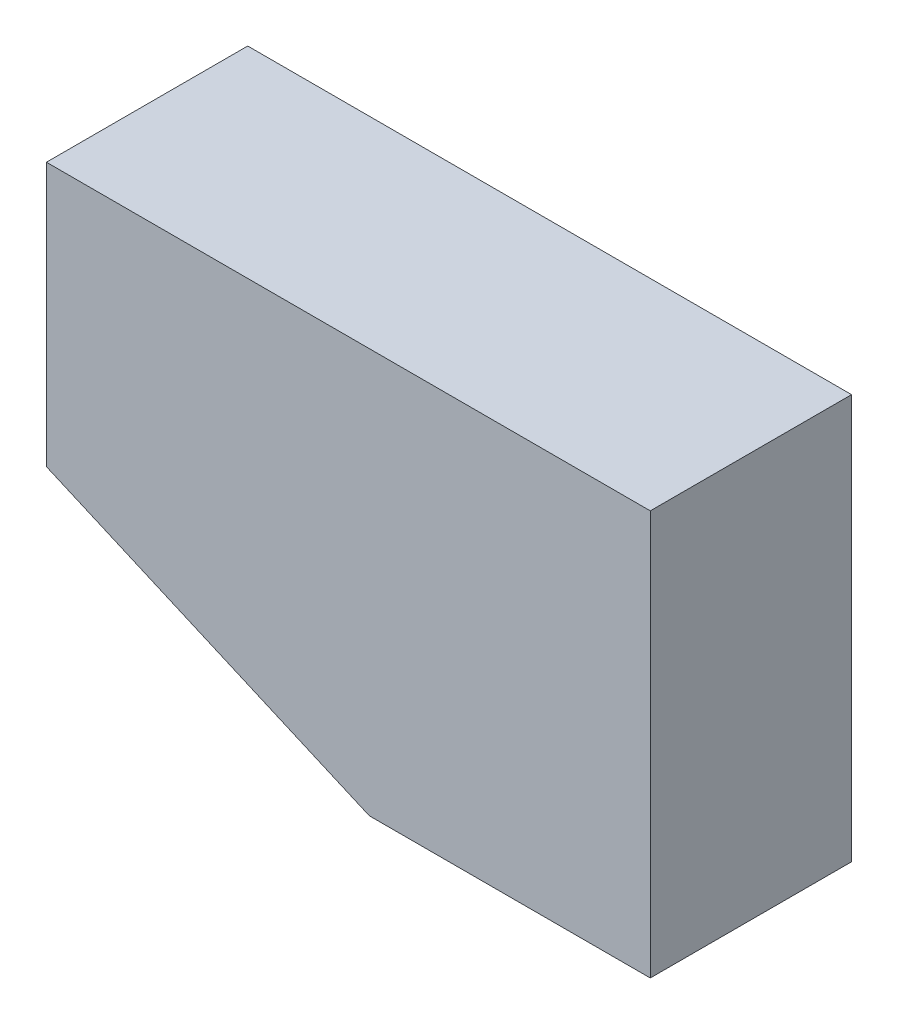
from build123d import *

# Parameters (mm, degrees)
BOSS_EXTRUDE1_DEPTH = 200
SHELL1_T            = -6
SKETCH4_W           = 600
SKETCH4_H           = 200
BOSS_EXTRUDE2_DEPTH = 2


with BuildPart() as part:
    # Sketch3 → Boss-Extrude1 (new body)
    with BuildSketch(Plane.XY):
        Polygon((9.153032832, -66.666666667), (329.933331479, -206.666666667), (609.153032832, -206.666666667), (609.153032832, 193.333333333), (9.153032832, 193.333333333), align=None)
    extrude(amount=BOSS_EXTRUDE1_DEPTH)

    # Shell1
    shell1_openings = [part.faces().sort_by_distance(p)[0] for p in [
        (309.153032832, 193.333333333, 100),
    ]]
    offset(amount=SHELL1_T, openings=shell1_openings, kind=Kind.INTERSECTION)

    # Sketch4 → Boss-Extrude2 (add)
    with BuildSketch(Plane(origin=(0, 193.333333333, 0), x_dir=(1, 0, 0), z_dir=(0, 1, 0))):
        with Locations((309.153032832, -100)):
            Rectangle(SKETCH4_W, SKETCH4_H)
    extrude(amount=BOSS_EXTRUDE2_DEPTH)


solid = part.part
